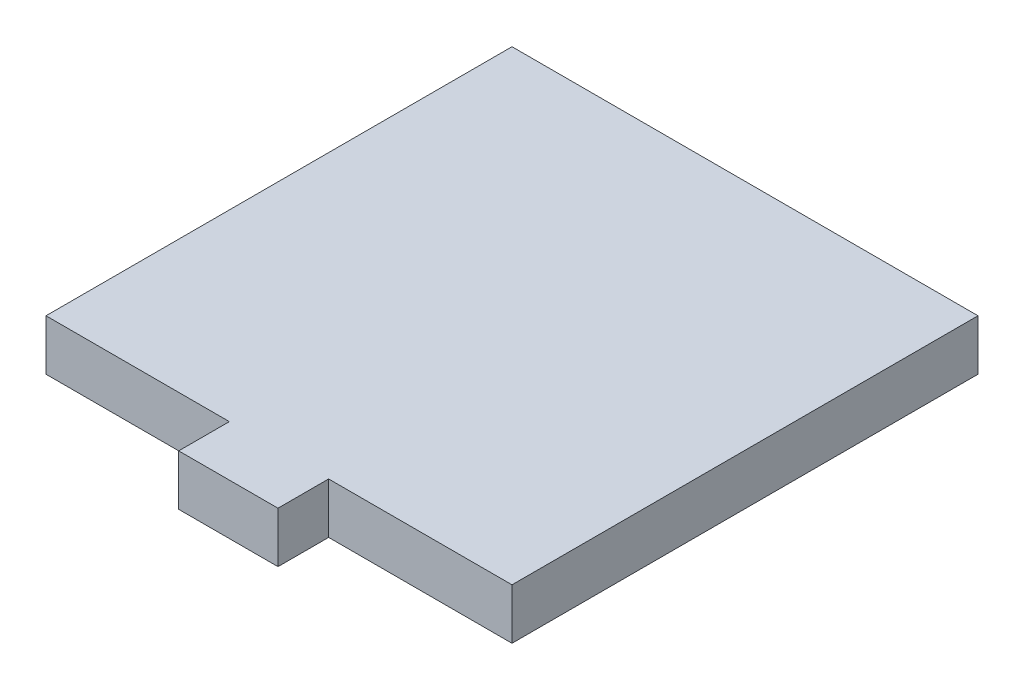
from build123d import *

# Parameters (mm, degrees)
SKETCH1_W           = 29.21
SKETCH1_H           = 29.21
BOSS_EXTRUDE1_DEPTH = 3.175
SKETCH2_W           = 6.223
SKETCH2_H           = 3.175
BOSS_EXTRUDE2_DEPTH = 3.175


with BuildPart() as part:
    # Sketch1 → Boss-Extrude1 (new body)
    with BuildSketch(Plane(origin=(0, 0, 0), x_dir=(1, 0, 0), z_dir=(0, 1, 0))):
        Rectangle(SKETCH1_W, SKETCH1_H)
    extrude(amount=BOSS_EXTRUDE1_DEPTH)

    # Sketch2 → Boss-Extrude2 (add)
    with BuildSketch(Plane.XY.offset(14.605)):
        with Locations((0, 1.5875)):
            Rectangle(SKETCH2_W, SKETCH2_H)
    extrude(amount=BOSS_EXTRUDE2_DEPTH)


solid = part.part
